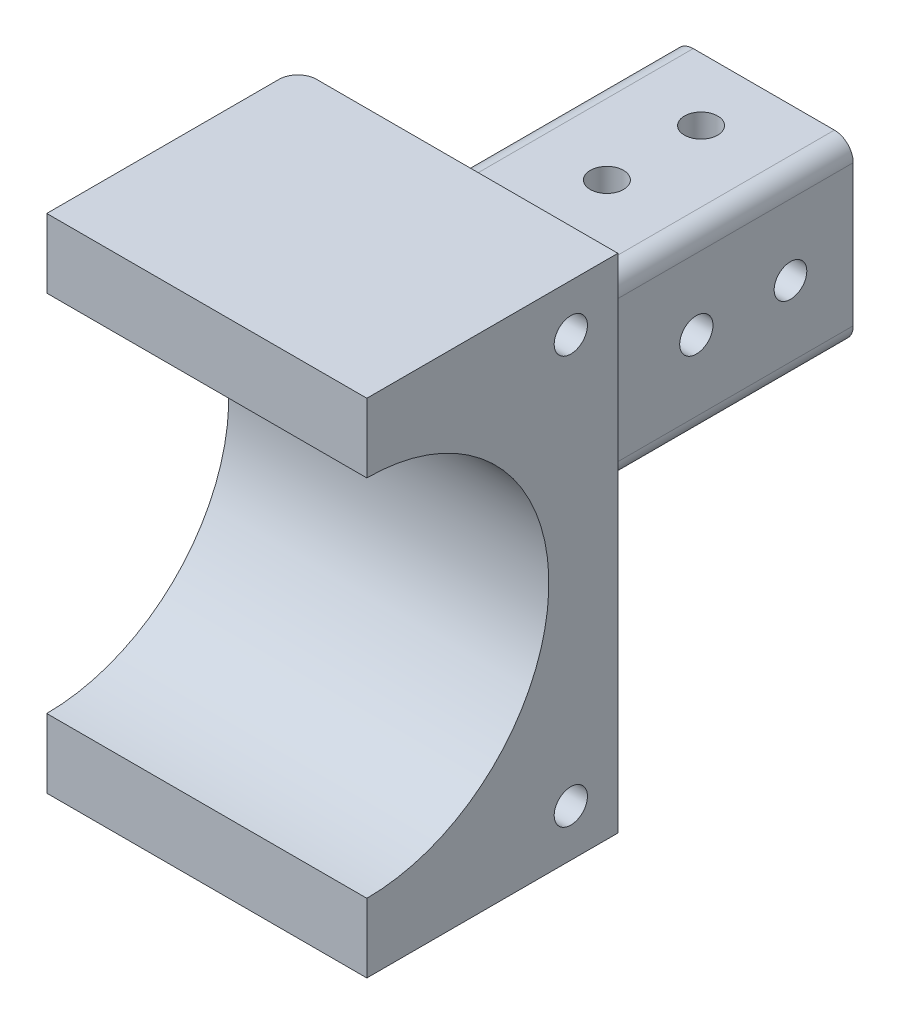
from build123d import *

# Parameters (mm, degrees)
SKETCH_1_W          = 28.5
SKETCH_1_H          = 28.5
SKETCH_1_W_2        = 20.5
SKETCH_1_H_2        = 20.5
EXTRUDE_1_DEPTH     = 30
SKETCH_2_W          = 80
SKETCH_2_H          = 80
SKETCH_2_R          = 29
EXTRUDE_2_DEPTH     = 51
FILLET_1_R          = 22
CUT_EXTRUDE_1_DEPTH = 51
SKETCH_5_W          = 28.5
SKETCH_5_H          = 28.5
SKETCH_5_W_2        = 20.5
SKETCH_5_H_2        = 20.5
EXTRUDE_3_DEPTH     = 30
SKETCH_6_R          = 2.6
SKETCH_6_R_2        = 2.65
CUT_EXTRUDE_2_DEPTH = 30
SKETCH_7_R          = 2.65
CUT_EXTRUDE_3_DEPTH = 30
SKETCH_8_R          = 2.65
CUT_EXTRUDE_4_DEPTH = 96.399161422
FILLET_3_R          = 3


with BuildPart() as part:
    # 草图1 → 凸台-拉伸1 (new body)
    with BuildSketch(Plane.XY):
        Rectangle(SKETCH_1_W, SKETCH_1_H)
        Rectangle(SKETCH_1_W_2, SKETCH_1_H_2, mode=Mode.SUBTRACT)
    extrude(amount=EXTRUDE_1_DEPTH)

    # 草图2 → 凸台-拉伸2 (add)
    with BuildSketch(Plane.ZY.offset(14.25)):
        with Locations((70, 0)):
            Rectangle(SKETCH_2_W, SKETCH_2_H)
        with Locations((70, 0)):
            Circle(SKETCH_2_R, mode=Mode.SUBTRACT)
    extrude(amount=-EXTRUDE_2_DEPTH)

    # 圆角1
    fillet_1_edges = [part.edges().sort_by_distance(p)[0] for p in [
        (14.25, 0, 30),
        (0, 14.25, 30),
        (0, -14.25, 30),
    ]]
    fillet(fillet_1_edges, radius=FILLET_1_R)

    # 草图3 → 切除-拉伸1 (cut)
    with BuildSketch(Plane.ZY.offset(14.25)):
        with BuildLine():
            Line((70, -29), (70, -40))
            Line((70, -40), (110, -40))
            Line((110, -40), (110, 40))
            Line((110, 40), (70, 40))
            Line((70, 40), (70, 29))
            ThreePointArc((70, 29), (90.506096654, 20.506096654), (99, 0))
            ThreePointArc((99, 0), (90.506096654, -20.506096654), (70, -29))
        make_face()
    extrude(amount=-CUT_EXTRUDE_1_DEPTH, mode=Mode.SUBTRACT)

    # 草图5 → 凸台-拉伸3 (add)
    with BuildSketch(Plane(origin=(0, 0, 0), x_dir=(-1, 0, 0), z_dir=(0, 0, -1))):
        Rectangle(SKETCH_5_W, SKETCH_5_H)
        Rectangle(SKETCH_5_W_2, SKETCH_5_H_2, mode=Mode.SUBTRACT)
    extrude(amount=EXTRUDE_3_DEPTH)

    # 草图6 → 切除-拉伸2 (cut)
    with BuildSketch(Plane(origin=(14.25, 0, 0), x_dir=(0, 0, -1), z_dir=(1, 0, 0))):
        with Locations((20, 0)):
            Circle(SKETCH_6_R)
        with Locations((5, 0)):
            Circle(SKETCH_6_R_2)
    extrude(amount=-CUT_EXTRUDE_2_DEPTH, mode=Mode.SUBTRACT)

    # 草图7 → 切除-拉伸3 (cut)
    with BuildSketch(Plane(origin=(0, 14.25, 0), x_dir=(1, 0, 0), z_dir=(0, 1, 0))):
        with Locations(Location((0, 20, 0), (0, 0, 270))):
            Circle(SKETCH_7_R)
        with Locations(Location((0, 5, 0), (0, 0, 270))):
            Circle(SKETCH_7_R)
    extrude(amount=-CUT_EXTRUDE_3_DEPTH, mode=Mode.SUBTRACT)

    # 草图8 → 切除-拉伸4 (cut, through all)
    with BuildSketch(Plane.ZY.offset(14.25)):
        with Locations((37.5, 32.5)):
            Circle(SKETCH_8_R)
        with Locations((37.5, -32.5)):
            Circle(SKETCH_8_R)
    extrude(amount=-CUT_EXTRUDE_4_DEPTH, mode=Mode.SUBTRACT)

    # 圆角3
    fillet_3_edges = [part.edges().sort_by_distance(p)[0] for p in [
        (-14.25, -38.125, 30),
        (-14.25, 38.125, 30),
        (14.25, -14.25, -11),
        (-14.25, -14.25, -11),
        (14.25, 14.25, -11),
        (-14.25, 14.25, -11),
        (-14.25, -20.693650814, 23.556349186),
        (-14.25, 20.693650814, 23.556349186),
        (22.036924037, 22.036924037, 24.792512369),
        (22.036924037, -22.036924037, 24.792512369),
    ]]
    fillet(fillet_3_edges, radius=FILLET_3_R)


solid = part.part
